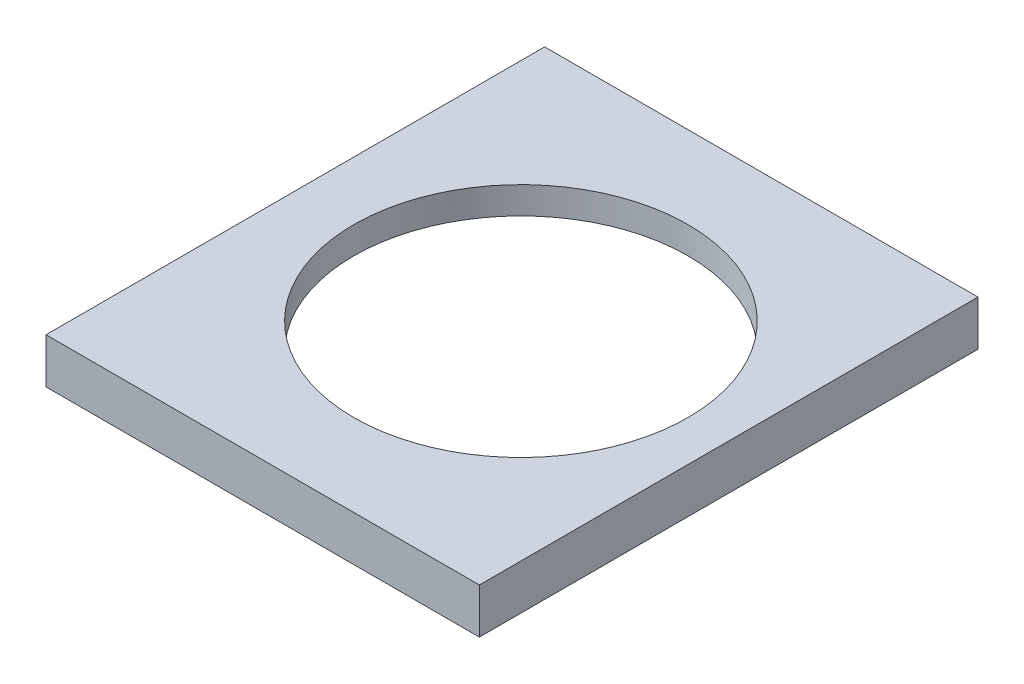
from build123d import *

# Parameters (mm, degrees)
SKETCH1_W           = 47.974978614
SKETCH1_H           = 55.2
BOSS_EXTRUDE1_DEPTH = 3
SKETCH3_R           = 18.5
CUT_EXTRUDE2_DEPTH  = 8
SKETCH7_W           = 0.709516438
SKETCH7_H           = 55.2
SKETCH7_W_2         = 1.2
BOSS_EXTRUDE2_DEPTH = 2
SKETCH8_W           = 46.065462176
SKETCH8_H           = 0.744802826
SKETCH8_H_2         = 1.099561045
BOSS_EXTRUDE3_DEPTH = 2
SKETCH9_R           = 2
CUT_EXTRUDE4_DEPTH  = 2.5


with BuildPart() as part:
    # Sketch1 → Boss-Extrude1 (new body)
    with BuildSketch(Plane(origin=(0, 0, 0), x_dir=(1, 0, 0), z_dir=(0, 1, 0))):
        with Locations((-0.987489307, 0)):
            Rectangle(SKETCH1_W, SKETCH1_H)
    extrude(amount=BOSS_EXTRUDE1_DEPTH)

    # Sketch3 → Cut-Extrude2 (cut)
    with BuildSketch(Plane(origin=(0, 3, 0), x_dir=(1, 0, 0), z_dir=(0, 1, 0))):
        with Locations(Location((0, 0, 0), (0, 0, 270))):
            Circle(SKETCH3_R)
    extrude(amount=-CUT_EXTRUDE2_DEPTH, mode=Mode.SUBTRACT)

    # Sketch7 → Boss-Extrude2 (add)
    with BuildSketch(Plane.XZ):
        with Locations((-24.620220395, 0)):
            Rectangle(SKETCH7_W, SKETCH7_H)
        with Locations((22.4, 0)):
            Rectangle(SKETCH7_W_2, SKETCH7_H)
    extrude(amount=BOSS_EXTRUDE2_DEPTH)

    # Sketch8 → Boss-Extrude3 (add)
    with BuildSketch(Plane.XZ):
        with Locations((-1.232731088, 27.227598587)):
            Rectangle(SKETCH8_W, SKETCH8_H)
        with Locations((-1.232731088, -27.050219478)):
            Rectangle(SKETCH8_W, SKETCH8_H_2)
    extrude(amount=BOSS_EXTRUDE3_DEPTH)

    # Sketch9 → Cut-Extrude4 (cut)
    with BuildSketch(Plane.XZ):
        with Locations(Location((-19.324035892, 18.962761771, 0), (0, 0, 270))):
            Circle(SKETCH9_R)
        with Locations(Location((18.115964108, 18.962761771, 0), (0, 0, 270))):
            Circle(SKETCH9_R)
        with Locations(Location((-19.324035892, -18.477238229, 0), (0, 0, 270))):
            Circle(SKETCH9_R)
        with Locations(Location((18.115964108, -18.477238229, 0), (0, 0, 270))):
            Circle(SKETCH9_R)
    extrude(amount=-CUT_EXTRUDE4_DEPTH, mode=Mode.SUBTRACT)


solid = part.part
